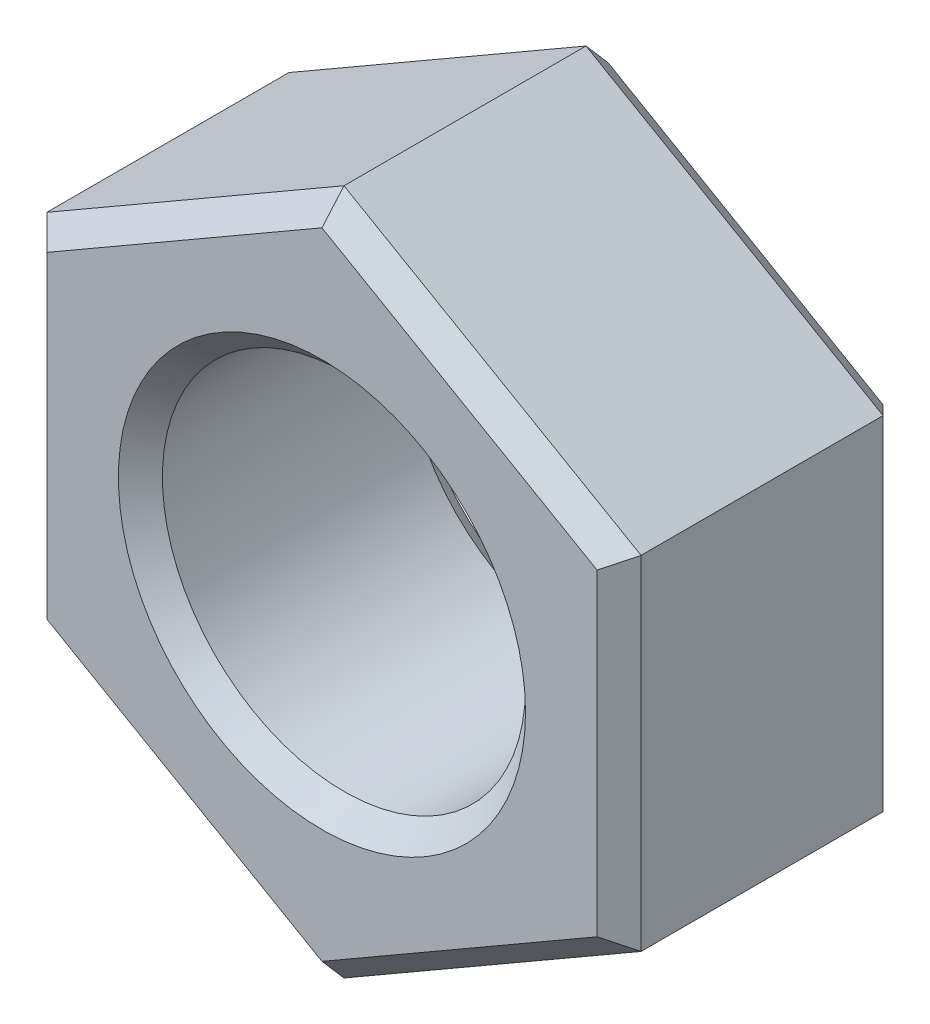
from build123d import *

# Parameters (mm, degrees)
SKETCH1_R           = 1.65
BOSS_EXTRUDE1_DEPTH = 1.3
DEBURS_SIZE         = 0.2


with BuildPart() as part:
    # Sketch1 → Boss-Extrude1 (new, symmetric)
    with BuildSketch(Plane.XY):
        Polygon((2.7, -1.558845727), (2.7, 1.558845727), (0, 3.117691454), (-2.7, 1.558845727), (-2.7, -1.558845727), (0, -3.117691454), align=None)
        Circle(SKETCH1_R, mode=Mode.SUBTRACT)
    extrude(amount=BOSS_EXTRUDE1_DEPTH, both=True)

    # Deburs
    deburs_edges = [part.edges().sort_by_distance(p)[0] for p in [
        (1.35, 2.33826859, 1.3),
        (-1.35, 2.33826859, 1.3),
        (-1.65, 0, -1.3),
        (-1.65, 0, 1.3),
        (-2.7, 0, 1.3),
        (-1.35, -2.33826859, 1.3),
        (1.35, -2.33826859, 1.3),
        (-1.35, -2.33826859, -1.3),
        (-2.7, 0, -1.3),
        (-1.35, 2.33826859, -1.3),
        (1.35, 2.33826859, -1.3),
        (2.7, 0, -1.3),
        (1.35, -2.33826859, -1.3),
        (2.7, 0, 1.3),
    ]]
    chamfer(deburs_edges, length=DEBURS_SIZE)


solid = part.part
